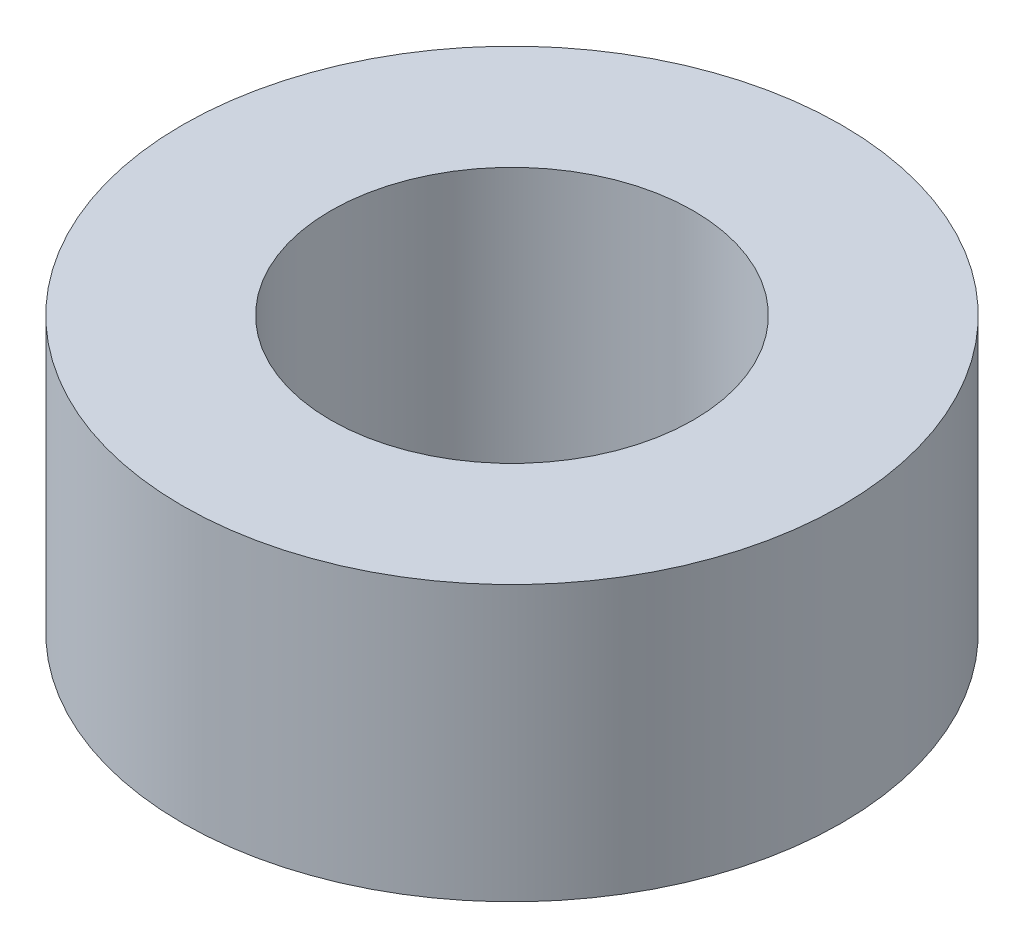
from build123d import *

# Parameters (mm, degrees)
SKETCH_1_R      = 3
SKETCH_1_R_2    = 1.65
EXTRUDE_1_DEPTH = 2.5


with BuildPart() as part:
    # 草图1 → 凸台-拉伸1 (new body)
    with BuildSketch(Plane(origin=(0, 0, 0), x_dir=(1, 0, 0), z_dir=(0, 1, 0))):
        with Locations(Location((0, 0, 0), (0, 0, 270))):
            Circle(SKETCH_1_R)
        with Locations(Location((0, 0, 0), (0, 0, 270))):
            Circle(SKETCH_1_R_2, mode=Mode.SUBTRACT)
    extrude(amount=EXTRUDE_1_DEPTH)


solid = part.part
